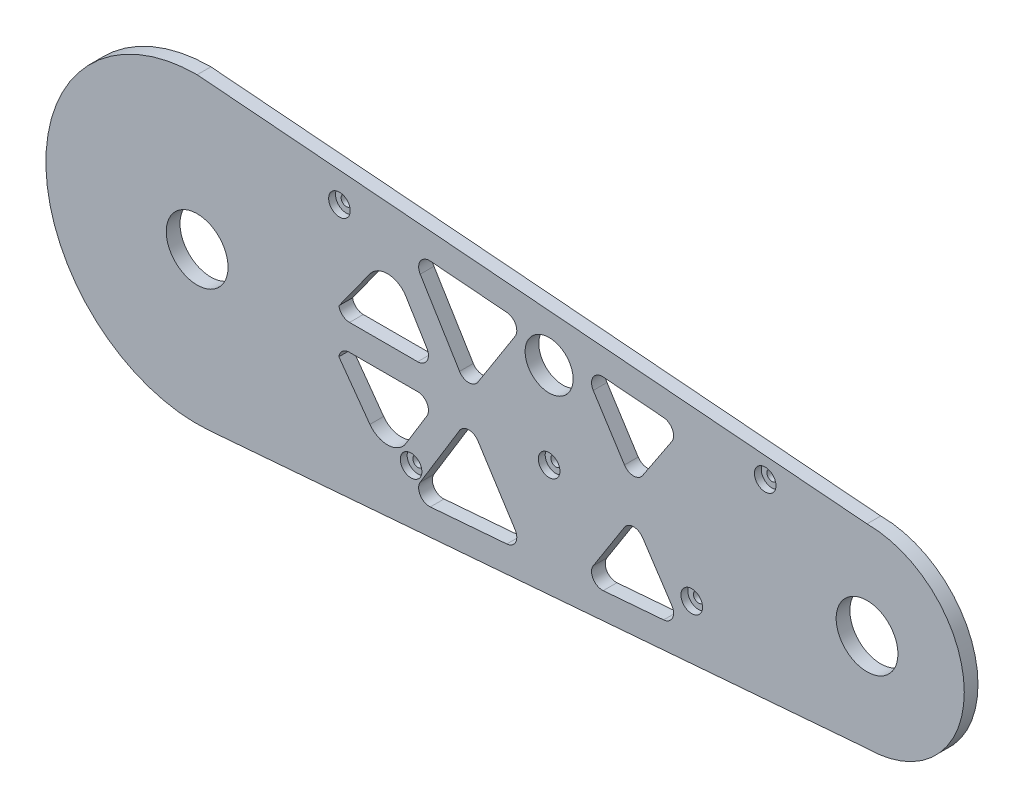
from build123d import *

# Parameters (mm, degrees)
SKETCH1_R             = 14.29385
SKETCH1_R_2           = 11.1125
BOSS_EXTRUDE1_DEPTH   = 6.35
CROQUIS1_R            = 2.38125
CORTAR_EXTRUIR1_DEPTH = 50
CROQUIS6_R            = 2.38125
CORTAR_EXTRUIR4_DEPTH = 10
CROQUIS7_R            = 2.38125
CORTAR_EXTRUIR5_DEPTH = 10
CROQUIS9_R            = 5
CORTAR_EXTRUIR6_DEPTH = 3.18


with BuildPart() as part:
    # Sketch1 → Boss-Extrude1 (new body)
    with BuildSketch(Plane.XY):
        with BuildLine():
            Line((0, 70), (310, 45))
            ThreePointArc((310, 45), (355, 0), (310, -45))
            Line((310, -45), (5.171398252, -69.808714643))
            ThreePointArc((5.171398252, -69.808714643), (-69.952162315, -2.587467389), (0, 70))
        make_face()
        Circle(SKETCH1_R, mode=Mode.SUBTRACT)
        with Locations((310, 0)):
            Circle(SKETCH1_R, mode=Mode.SUBTRACT)
        with Locations((162.878542763, 35)):
            Circle(SKETCH1_R_2, mode=Mode.SUBTRACT)
        with BuildLine():
            Line((107.898974887, 49.259511156), (143.314248041, 46.40344074))
            ThreePointArc((143.314248041, 46.40344074), (147.389908855, 43.644764005), (147.127454118, 38.730252238))
            Line((147.127454118, 38.730252238), (129.916226305, 11.754586611))
            ThreePointArc((129.916226305, 11.754586611), (125.651076231, 9.444205574), (121.433006579, 11.839462159))
            Line((121.433006579, 11.839462159), (103.228961238, 41.671198203))
            ThreePointArc((103.228961238, 41.671198203), (103.238833139, 46.896293531), (107.898974887, 49.259511156))
        make_face(mode=Mode.SUBTRACT)
        with BuildLine():
            Line((70.523244027, 6), (102.03004784, 6))
            ThreePointArc((102.03004784, 6), (106.3902351, 8.552804247), (106.298140539, 13.604493178))
            Line((106.298140539, 13.604493178), (96.590354482, 29.513051181))
            ThreePointArc((96.590354482, 29.513051181), (88.437172177, 34.296727565), (79.941746192, 30.151166228))
            Line((79.941746192, 30.151166228), (65.58297828, 10.229432452))
            ThreePointArc((65.58297828, 10.229432452), (67.271539685, 7.201787411), (70.523244027, 6))
        make_face(mode=Mode.SUBTRACT)
        with BuildLine():
            Line((219.623774494, 32.810522613), (206.130928429, 12.417497436))
            ThreePointArc((206.130928429, 12.417497436), (201.919524559, 10.176643248), (197.745901529, 12.48710226))
            Line((197.745901529, 12.48710226), (183.296864227, 35.133505128))
            ThreePointArc((183.296864227, 35.133505128), (183.227765467, 40.400743015), (187.913912204, 42.80669363))
            Line((187.913912204, 42.80669363), (215.855795571, 40.553315939))
            ThreePointArc((215.855795571, 40.553315939), (219.949772588, 37.757395035), (219.623774494, 32.810522613))
        make_face(mode=Mode.SUBTRACT)
        with BuildLine():
            Line((96.590354482, -29.513051181), (106.298140539, -13.604493178))
            ThreePointArc((106.298140539, -13.604493178), (106.3902351, -8.552804247), (102.03004784, -6))
            Line((102.03004784, -6), (70.523244027, -6))
            ThreePointArc((70.523244027, -6), (67.271539685, -7.201787411), (65.58297828, -10.229432452))
            Line((65.58297828, -10.229432452), (79.941746192, -30.151166228))
            ThreePointArc((79.941746192, -30.151166228), (88.437172177, -34.296727565), (96.590354482, -29.513051181))
        make_face(mode=Mode.SUBTRACT)
        with BuildLine():
            Line((187.913912204, -42.80669363), (215.855795571, -40.553315939))
            ThreePointArc((215.855795571, -40.553315939), (219.949772588, -37.757395035), (219.623774494, -32.810522613))
            Line((219.623774494, -32.810522613), (206.130928429, -12.417497436))
            ThreePointArc((206.130928429, -12.417497436), (201.919524559, -10.176643248), (197.745901529, -12.48710226))
            Line((197.745901529, -12.48710226), (183.296864227, -35.133505128))
            ThreePointArc((183.296864227, -35.133505128), (183.227765467, -40.400743015), (187.913912204, -42.80669363))
        make_face(mode=Mode.SUBTRACT)
        with BuildLine():
            Line((121.433006579, -11.839462159), (103.228961238, -41.671198203))
            ThreePointArc((103.228961238, -41.671198203), (103.238833139, -46.896293531), (107.898974887, -49.259511156))
            Line((107.898974887, -49.259511156), (143.314248041, -46.40344074))
            ThreePointArc((143.314248041, -46.40344074), (147.389908855, -43.644764005), (147.127454118, -38.730252238))
            Line((147.127454118, -38.730252238), (129.916226305, -11.754586611))
            ThreePointArc((129.916226305, -11.754586611), (125.651076231, -9.444205574), (121.433006579, -11.839462159))
        make_face(mode=Mode.SUBTRACT)
    extrude(amount=BOSS_EXTRUDE1_DEPTH)

    # Croquis1 → Cortar-Extruir1 (cut)
    with BuildSketch(Plane.XY.offset(6.35)):
        with Locations((98.995555235, -37.090103176)):
            Circle(CROQUIS1_R)
        with Locations((228.877351461, -26.519571404)):
            Circle(CROQUIS1_R)
    extrude(amount=-CORTAR_EXTRUIR1_DEPTH, mode=Mode.SUBTRACT)

    # Croquis6 → Cortar-Extruir4 (cut)
    with BuildSketch(Plane(origin=(0, 0, 0), x_dir=(-1, 0, 0), z_dir=(0, 0, -1))):
        with Locations((-162.878542763, -5)):
            Circle(CROQUIS6_R)
    extrude(amount=-CORTAR_EXTRUIR4_DEPTH, mode=Mode.SUBTRACT)

    # Croquis7 → Cortar-Extruir5 (cut)
    with BuildSketch(Plane(origin=(0, 0, 0), x_dir=(-1, 0, 0), z_dir=(0, 0, -1))):
        with Locations((-65.84135797, 50.868973694)):
            Circle(CROQUIS7_R)
        with Locations((-262.871569638, 39.210126075)):
            Circle(CROQUIS7_R)
    extrude(amount=-CORTAR_EXTRUIR5_DEPTH, mode=Mode.SUBTRACT)

    # Croquis9 → Cortar-Extruir6 (cut)
    with BuildSketch(Plane.XY.offset(6.35)):
        with Locations((65.84135797, 50.868973694)):
            Circle(CROQUIS9_R)
        with Locations((162.878542763, -5)):
            Circle(CROQUIS9_R)
        with Locations((98.995555235, -37.090103176)):
            Circle(CROQUIS9_R)
        with Locations((228.877351461, -26.519571404)):
            Circle(CROQUIS9_R)
        with Locations((262.871569638, 39.210126075)):
            Circle(CROQUIS9_R)
    extrude(amount=-CORTAR_EXTRUIR6_DEPTH, mode=Mode.SUBTRACT)


solid = part.part
